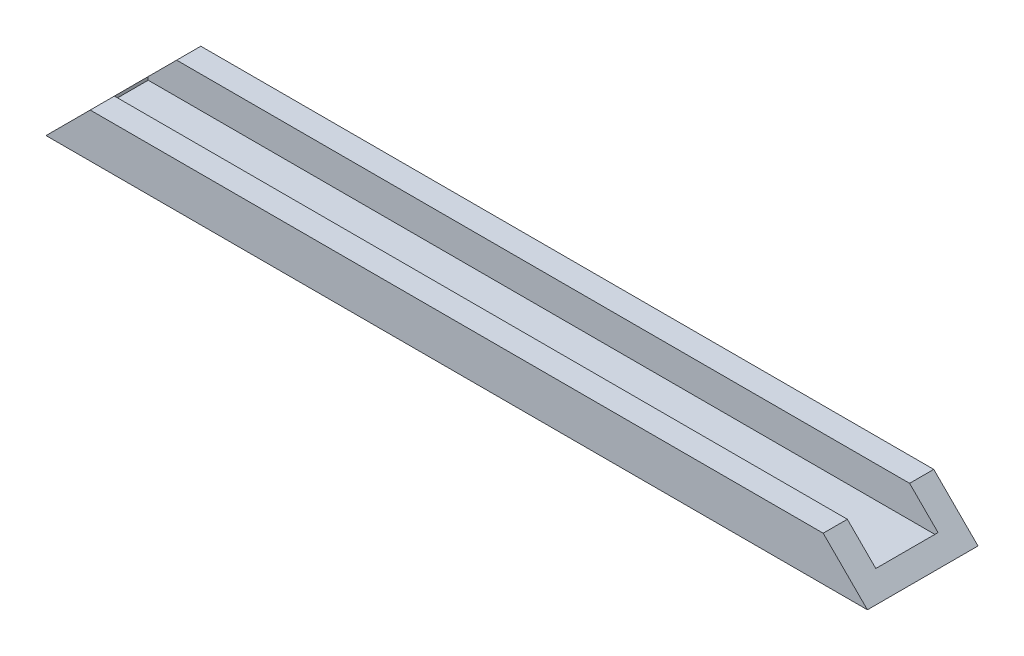
from build123d import *

# Parameters (mm, degrees)
SKETCH1_W          = 165.1
SKETCH1_H          = 22.225
BASE_EXTRUDE_DEPTH = 8.89
SKETCH3_W          = 158.75
SKETCH3_H          = 12.5095
PIECE_CUT_DEPTH    = 6.35
CORNER_CUT_DEPTH   = 167.826235122


with BuildPart() as part:
    # Sketch1 → Base Extrude (new body)
    with BuildSketch(Plane(origin=(0, 0, 0), x_dir=(1, 0, 0), z_dir=(0, 1, 0))):
        with Locations((82.55, 11.1125)):
            Rectangle(SKETCH1_W, SKETCH1_H)
    extrude(amount=BASE_EXTRUDE_DEPTH)

    # Sketch3 → Piece Cut (cut)
    with BuildSketch(Plane(origin=(0, 8.89, 0), x_dir=(1, 0, 0), z_dir=(0, 1, 0))):
        with Locations((82.55, 11.1125)):
            Rectangle(SKETCH3_W, SKETCH3_H)
    extrude(amount=-PIECE_CUT_DEPTH, mode=Mode.SUBTRACT)

    # Sketch4 → Corner Cut (cut, through all)
    with BuildSketch(Plane(origin=(0, 0, -22.225), x_dir=(-1, 0, 0), z_dir=(0, 0, -1))):
        Polygon((0, 0), (-8.89, 8.89), (0, 8.89), align=None)
        Polygon((-165.1, 8.89), (-156.21, 8.89), (-165.1, 0), align=None)
    extrude(amount=-CORNER_CUT_DEPTH, mode=Mode.SUBTRACT)


solid = part.part
